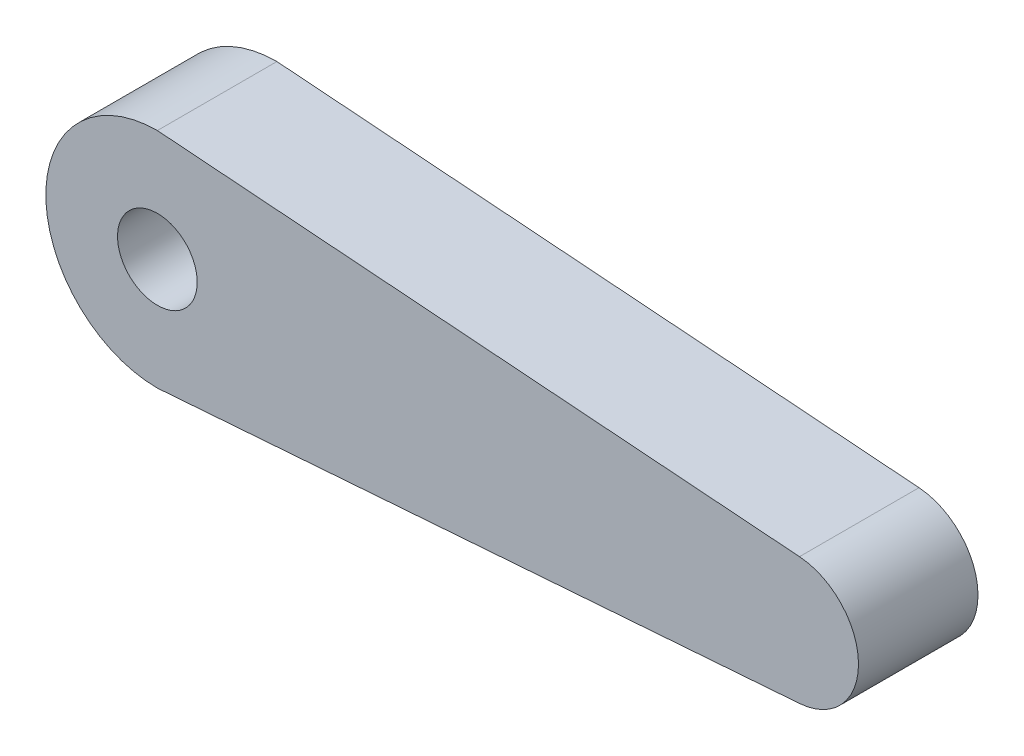
from build123d import *

# Parameters (mm, degrees)
BOSS_EXTRU_1_DEPTH           = 15
ENL_V_MAT_EXTRU_1_DEPTH      = 91.360389552
ENL_V_MAT_EXTRU_1_DEPTH_BACK = 91.360389552
ESQUISSE3_R                  = 5


with BuildPart() as part:
    # Esquisse1 → Boss.-Extru.1 (new body)
    with BuildSketch(Plane.XY):
        with BuildLine():
            Line((80.596108007, 7.977760039), (0, 14))
            ThreePointArc((0, 14), (-14, 0), (0, -14))
            Line((0, -14), (80.596108007, -7.977760039))
            ThreePointArc((80.596108007, -7.977760039), (88, 0), (80.596108007, 7.977760039))
        make_face()
    extrude(amount=BOSS_EXTRU_1_DEPTH)

    # Esquisse3 → Enlèv. mat.-Extru.1 (cut, two sides: drawn at the far end of the back side and taken through both)
    with BuildSketch(Plane.XY.offset(15).offset(-ENL_V_MAT_EXTRU_1_DEPTH_BACK)):
        Circle(ESQUISSE3_R)
    extrude(amount=ENL_V_MAT_EXTRU_1_DEPTH + ENL_V_MAT_EXTRU_1_DEPTH_BACK, mode=Mode.SUBTRACT)


solid = part.part
